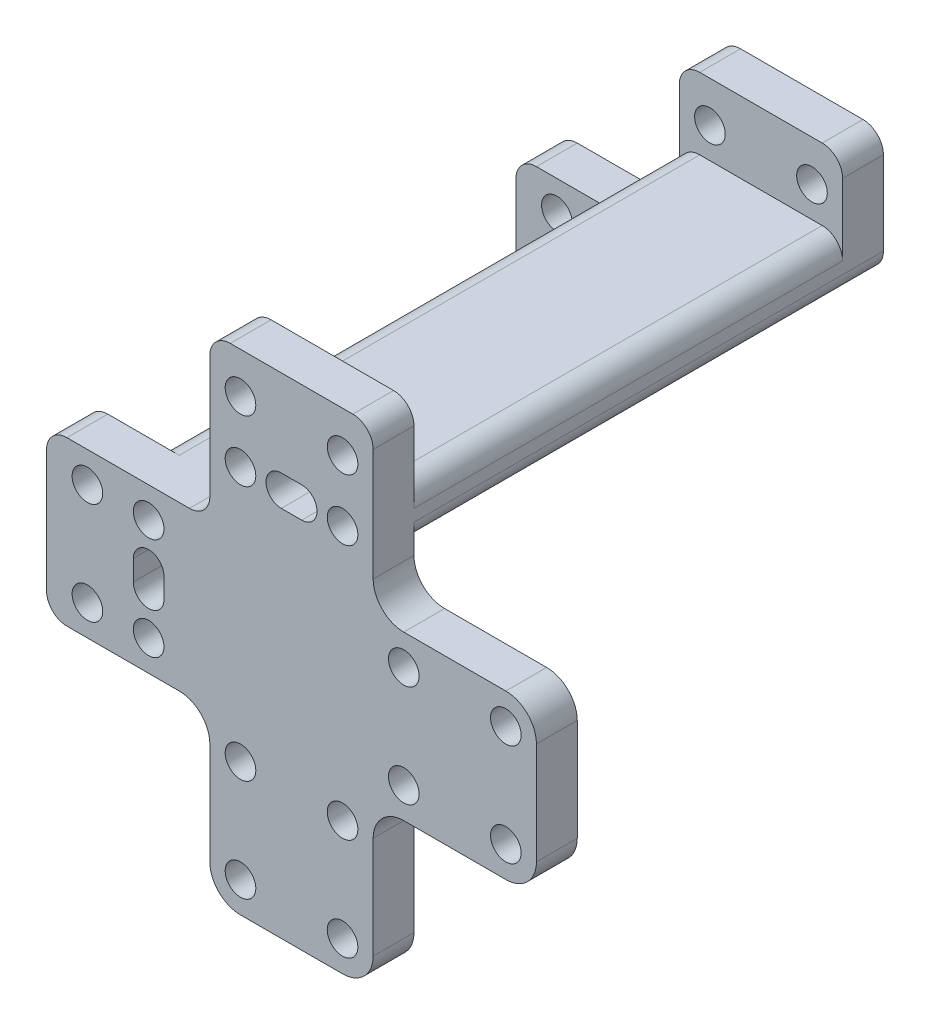
from build123d import *

# Parameters (mm, degrees)
SKETCH_1_R          = 1.5
EXTRUDE_1_DEPTH     = 4
SKETCH_2_R          = 1.5
EXTRUDE_2_DEPTH     = 16
CUT_EXTRUDE_4_DEPTH = 10
SKETCH_5_R          = 1.25
CUT_EXTRUDE_5_DEPTH = 8
SKETCH_6_R          = 1.5
EXTRUDE_3_DEPTH     = 30
CUT_EXTRUDE_6_DEPTH = 29
FILLET_2_R          = 2
SKETCH_11_R         = 1.5
EXTRUDE_4_DEPTH     = 4
FILLET_3_R          = 3
EXTRUDE_START       = -4
SKETCH_13_R         = 1.5
EXTRUDE_5_DEPTH     = 4


with BuildPart() as part:
    # 草图1 → 凸台-拉伸1 (new body)
    # profile 1 of 3: a face of its own
    with BuildSketch(Plane.XY):
        Polygon((-24, -8), (-13, -8), (-4, 1), (-8, 1), (-8, 8), (-24, 8), align=None)
        with Locations((-20, -5)):
            Circle(SKETCH_1_R, mode=Mode.SUBTRACT)
        with Locations((-20, 5)):
            Circle(SKETCH_1_R, mode=Mode.SUBTRACT)
    # profile 2 of 3: a face of its own
    with BuildSketch(Plane.XY):
        Polygon((-1, 8), (-1, 4), (8, 13), (8, 24), (-8, 24), (-8, 8), align=None)
        with Locations((-5, 20)):
            Circle(SKETCH_1_R, mode=Mode.SUBTRACT)
        with Locations((5, 20)):
            Circle(SKETCH_1_R, mode=Mode.SUBTRACT)
    # profile 3 of 3: a face of its own
    with BuildSketch(Plane.XY):
        Polygon((-8, 1), (-4, 1), (-1, 4), (-1, 8), (-8, 8), align=None)
        with Locations((-5, 5)):
            Circle(SKETCH_1_R, mode=Mode.SUBTRACT)
    extrude(amount=EXTRUDE_1_DEPTH)

    # 草图2 → 凸台-拉伸2 (add)
    with BuildSketch(Plane.XY.offset(4)):
        Polygon((-8, 17), (8, 17), (8, 13), (-13, -8), (-17, -8), (-17, 8), (-8, 8), align=None)
        with Locations((-5, 5)):
            Circle(SKETCH_2_R, mode=Mode.SUBTRACT)
    extrude(amount=EXTRUDE_2_DEPTH)

    # 草图4 → 切除-拉伸4 (cut)
    with BuildSketch(Plane(origin=(0, 0, 0), x_dir=(-1, 0, 0), z_dir=(0, 0, -1))):
        Polygon((-2.171572875, 10), (6, 10), (6, 15), (-6, 15), (-6, 13.828427125), align=None)
        Polygon((10.27723117, 6), (10.27723117, -2.448804045), (13.828427125, -6), (15, -6), (15, 6), align=None)
    extrude(amount=-CUT_EXTRUDE_4_DEPTH, mode=Mode.SUBTRACT)

    # 草图5 → 切除-拉伸5 (cut)
    with BuildSketch(Plane.XY.offset(20)):
        with Locations((-14, 5)):
            Circle(SKETCH_5_R)
        with Locations((-14, -5)):
            Circle(SKETCH_5_R)
        with Locations((-5, 14)):
            Circle(SKETCH_5_R)
        with Locations((5, 14)):
            Circle(SKETCH_5_R)
    extrude(amount=-CUT_EXTRUDE_5_DEPTH, mode=Mode.SUBTRACT)

    # 草图6 → 凸台-拉伸3 (add)
    with BuildSketch(Plane.XY.offset(20)):
        Polygon((-17, 8), (-8, 8), (-8, 17), (8, 17), (8, 13), (-13, -8), (-17, -8), align=None)
        with Locations((-14, 5)):
            Circle(SKETCH_6_R, mode=Mode.SUBTRACT)
        with Locations((-14, -5)):
            Circle(SKETCH_6_R, mode=Mode.SUBTRACT)
        with Locations((-5, 14)):
            Circle(SKETCH_6_R, mode=Mode.SUBTRACT)
        with Locations((5, 14)):
            Circle(SKETCH_6_R, mode=Mode.SUBTRACT)
    extrude(amount=EXTRUDE_3_DEPTH)

    # 草图7 → 切除-拉伸6 (cut)
    with BuildSketch(Plane.XY.offset(50)):
        with BuildLine():
            Line((-1, 15.5), (1, 15.5))
            ThreePointArc((1, 15.5), (2.5, 14), (1, 12.5))
            Line((1, 12.5), (-1, 12.5))
            ThreePointArc((-1, 12.5), (-2.5, 14), (-1, 15.5))
        make_face()
        with BuildLine():
            Line((-12.5, 1), (-12.5, -1))
            ThreePointArc((-12.5, -1), (-14, -2.5), (-15.5, -1))
            Line((-15.5, -1), (-15.5, 1))
            ThreePointArc((-15.5, 1), (-14, 2.5), (-12.5, 1))
        make_face()
    extrude(amount=-CUT_EXTRUDE_6_DEPTH, mode=Mode.SUBTRACT)

    # 圆角2
    fillet_2_edges = [part.edges().sort_by_distance(p)[0] for p in [
        (-13, -8, 25),
        (-24, -8, 2),
        (-24, 8, 2),
        (-8, 8, 25),
        (-8, 24, 2),
        (8, 24, 2),
        (8, 13, 25),
        (-17, 8, 27),
        (-17, -8, 27),
        (8, 17, 27),
        (-8, 17, 27),
    ]]
    fillet(fillet_2_edges, radius=FILLET_2_R)

    # 草图11 → 凸台-拉伸4 (add)
    with BuildSketch(Plane.XY.offset(50)):
        with BuildLine():
            Line((-13.828427125, -8), (-8, -8))
            Line((-8, -8), (-8, -24))
            Line((-8, -24), (8, -24))
            Line((8, -24), (8, -8))
            Line((8, -8), (24, -8))
            Line((24, -8), (24, 8))
            Line((24, 8), (8, 8))
            Line((8, 8), (8, 13.828427125))
            ThreePointArc((8, 13.828427125), (7.847759065, 13.06306026), (7.414213562, 12.414213562))
            Line((7.414213562, 12.414213562), (-12.414213562, -7.414213562))
            ThreePointArc((-12.414213562, -7.414213562), (-13.06306026, -7.847759065), (-13.828427125, -8))
        make_face()
        with Locations((21, 5)):
            Circle(SKETCH_11_R, mode=Mode.SUBTRACT)
        with Locations((21, -5)):
            Circle(SKETCH_11_R, mode=Mode.SUBTRACT)
        with Locations((11, -5)):
            Circle(SKETCH_11_R, mode=Mode.SUBTRACT)
        with Locations((11, 5)):
            Circle(SKETCH_11_R, mode=Mode.SUBTRACT)
        with Locations(Location((5, -21, 0), (0, 0, 180))):
            Circle(SKETCH_11_R, mode=Mode.SUBTRACT)
        with Locations(Location((-5, -21, 0), (0, 0, 180))):
            Circle(SKETCH_11_R, mode=Mode.SUBTRACT)
        with Locations(Location((-5, -11, 0), (0, 0, 180))):
            Circle(SKETCH_11_R, mode=Mode.SUBTRACT)
        with Locations(Location((5, -11, 0), (0, 0, 180))):
            Circle(SKETCH_11_R, mode=Mode.SUBTRACT)
    extrude(amount=-EXTRUDE_4_DEPTH)

    # 圆角3
    fillet_3_edges = [part.edges().sort_by_distance(p)[0] for p in [
        (-8, -24, 48),
        (-8, -8, 48),
        (8, 8, 48),
        (24, 8, 48),
        (24, -8, 48),
        (8, -8, 48),
        (8, -24, 48),
    ]]
    fillet(fillet_3_edges, radius=FILLET_3_R)

    # 草图13 → 凸台-拉伸5 (add)
    # profile 1 of 2: a face of its own
    with BuildSketch(Plane.XY.offset(50).offset(EXTRUDE_START)):
        with BuildLine():
            ThreePointArc((8, 22), (7.414213562, 23.414213562), (6, 24))
            Line((6, 24), (-6, 24))
            ThreePointArc((-6, 24), (-7.414213562, 23.414213562), (-8, 22))
            Line((-8, 22), (-8, 15))
            ThreePointArc((-8, 15), (-7.414213562, 16.414213562), (-6, 17))
            Line((-6, 17), (6, 17))
            ThreePointArc((6, 17), (7.414213562, 16.414213562), (8, 15))
            Line((8, 15), (8, 22))
        make_face()
        with Locations((-5, 20)):
            Circle(SKETCH_13_R, mode=Mode.SUBTRACT)
        with Locations((5, 20)):
            Circle(SKETCH_13_R, mode=Mode.SUBTRACT)
    # profile 2 of 2: a face of its own
    with BuildSketch(Plane.XY.offset(50).offset(EXTRUDE_START)):
        with BuildLine():
            ThreePointArc((-17, 6), (-16.414213562, 7.414213562), (-15, 8))
            Line((-15, 8), (-22, 8))
            ThreePointArc((-22, 8), (-23.414213562, 7.414213562), (-24, 6))
            Line((-24, 6), (-24, -6))
            ThreePointArc((-24, -6), (-23.414213562, -7.414213562), (-22, -8))
            Line((-22, -8), (-15, -8))
            ThreePointArc((-15, -8), (-16.414213562, -7.414213562), (-17, -6))
            Line((-17, -6), (-17, 6))
        make_face()
        with Locations((-20, -5)):
            Circle(SKETCH_13_R, mode=Mode.SUBTRACT)
        with Locations((-20, 5)):
            Circle(SKETCH_13_R, mode=Mode.SUBTRACT)
    extrude(amount=EXTRUDE_5_DEPTH)


solid = part.part
